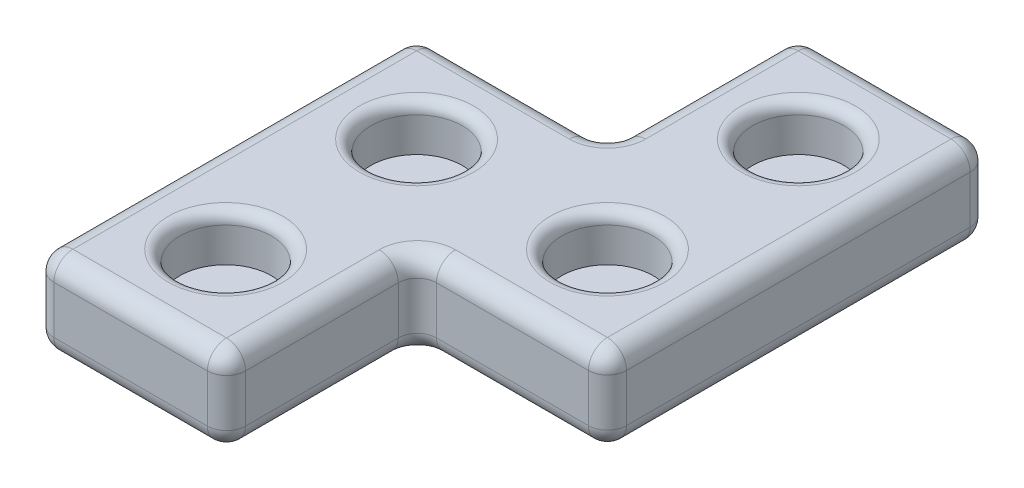
from build123d import *

# Parameters (mm, degrees)
BOSS_EXTRUDE1_DEPTH = 5.715
SKETCH2_R           = 3.048
CUT_EXTRUDE1_DEPTH  = 3.048
FILLET1_R           = 1.27
FILLET2_R           = 1.27
FILLET3_R           = 0.762


with BuildPart() as part:
    # Sketch1 → Boss-Extrude1 (new body)
    with BuildSketch(Plane(origin=(0, 0, 0), x_dir=(1, 0, 0), z_dir=(0, 1, 0))):
        with BuildLine():
            Line((-7.665886605, 2.665075851), (-7.665886605, 12.825075851))
            ThreePointArc((-7.665886605, 12.825075851), (-7.293912217, 13.723101463), (-6.395886605, 14.095075851))
            Line((-6.395886605, 14.095075851), (3.764113395, 14.095075851))
            ThreePointArc((3.764113395, 14.095075851), (4.662139007, 13.723101463), (5.034113395, 12.825075851))
            Line((5.034113395, 12.825075851), (5.034113395, -10.034924149))
            ThreePointArc((5.034113395, -10.034924149), (4.662139007, -10.932949761), (3.764113395, -11.304924149))
            Line((3.764113395, -11.304924149), (-6.340896914, -11.304924149))
            ThreePointArc((-6.340896914, -11.304924149), (-7.238922526, -11.676898537), (-7.610896914, -12.574924149))
            Line((-7.610896914, -12.574924149), (-7.610896914, -22.734924149))
            ThreePointArc((-7.610896914, -22.734924149), (-7.982871302, -23.632949761), (-8.880896914, -24.004924149))
            Line((-8.880896914, -24.004924149), (-19.095886605, -24.004924149))
            ThreePointArc((-19.095886605, -24.004924149), (-19.993912217, -23.632949761), (-20.365886605, -22.734924149))
            Line((-20.365886605, -22.734924149), (-20.365886605, 0.125075851))
            ThreePointArc((-20.365886605, 0.125075851), (-19.993912217, 1.023101463), (-19.095886605, 1.395075851))
            Line((-19.095886605, 1.395075851), (-8.935886605, 1.395075851))
            ThreePointArc((-8.935886605, 1.395075851), (-8.037860993, 1.767050239), (-7.665886605, 2.665075851))
        make_face()
    extrude(amount=BOSS_EXTRUDE1_DEPTH)

    # Sketch2 → Cut-Extrude1 (cut)
    with BuildSketch(Plane(origin=(0, 5.715, 0), x_dir=(1, 0, 0), z_dir=(0, 1, 0))):
        with Locations(Location((-1.315886605, 7.745075851, 0), (0, 0, 270))):
            Circle(SKETCH2_R)
        with Locations(Location((-14.015886605, -4.954924149, 0), (0, 0, 270))):
            Circle(SKETCH2_R)
        with Locations(Location((-14.015886605, -17.654924149, 0), (0, 0, 270))):
            Circle(SKETCH2_R)
        with Locations(Location((-1.315886605, -4.954924149, 0), (0, 0, 270))):
            Circle(SKETCH2_R)
    extrude(amount=-CUT_EXTRUDE1_DEPTH, mode=Mode.SUBTRACT)

    # Fillet1
    fillet1_edges = [part.edges().sort_by_distance(p)[0] for p in [
        (-19.993912217, 5.715, -1.023101463),
        (-20.365886605, 5.715, 11.304924149),
        (-19.993912217, 5.715, 23.632949761),
        (-13.988391759, 5.715, 24.004924149),
        (-7.982871302, 5.715, 23.632949761),
        (-7.610896914, 5.715, 17.654924149),
        (-7.238922526, 5.715, 11.676898537),
        (-1.288391759, 5.715, 11.304924149),
        (4.662139007, 5.715, 10.932949761),
        (5.034113395, 5.715, -1.395075851),
        (-8.037860993, 5.715, -1.767050239),
        (4.662139007, 5.715, -13.723101463),
        (-1.315886605, 5.715, -14.095075851),
        (-7.293912217, 5.715, -13.723101463),
        (-7.665886605, 5.715, -7.745075851),
        (-14.015886605, 5.715, -1.395075851),
    ]]
    fillet(fillet1_edges, radius=FILLET1_R)

    # Fillet2
    fillet2_edges = [part.edges().sort_by_distance(p)[0] for p in [
        (-7.665886605, 0, -7.745075851),
        (-7.293912217, 0, -13.723101463),
        (-1.315886605, 0, -14.095075851),
        (4.662139007, 0, -13.723101463),
        (5.034113395, 0, -1.395075851),
        (4.662139007, 0, 10.932949761),
        (-1.288391759, 0, 11.304924149),
        (-7.238922526, 0, 11.676898537),
        (-7.610896914, 0, 17.654924149),
        (-7.982871302, 0, 23.632949761),
        (-13.988391759, 0, 24.004924149),
        (-19.993912217, 0, 23.632949761),
        (-20.365886605, 0, 11.304924149),
        (-19.993912217, 0, -1.023101463),
        (-14.015886605, 0, -1.395075851),
        (-8.037860993, 0, -1.767050239),
    ]]
    fillet(fillet2_edges, radius=FILLET2_R)

    # Fillet3
    fillet3_edges = [part.edges().sort_by_distance(p)[0] for p in [
        (-1.315886605, 5.715, -10.793075851),
        (-14.015886605, 5.715, 1.906924149),
        (-14.015886605, 5.715, 14.606924149),
        (-1.315886605, 5.715, 1.906924149),
    ]]
    fillet(fillet3_edges, radius=FILLET3_R)


solid = part.part
